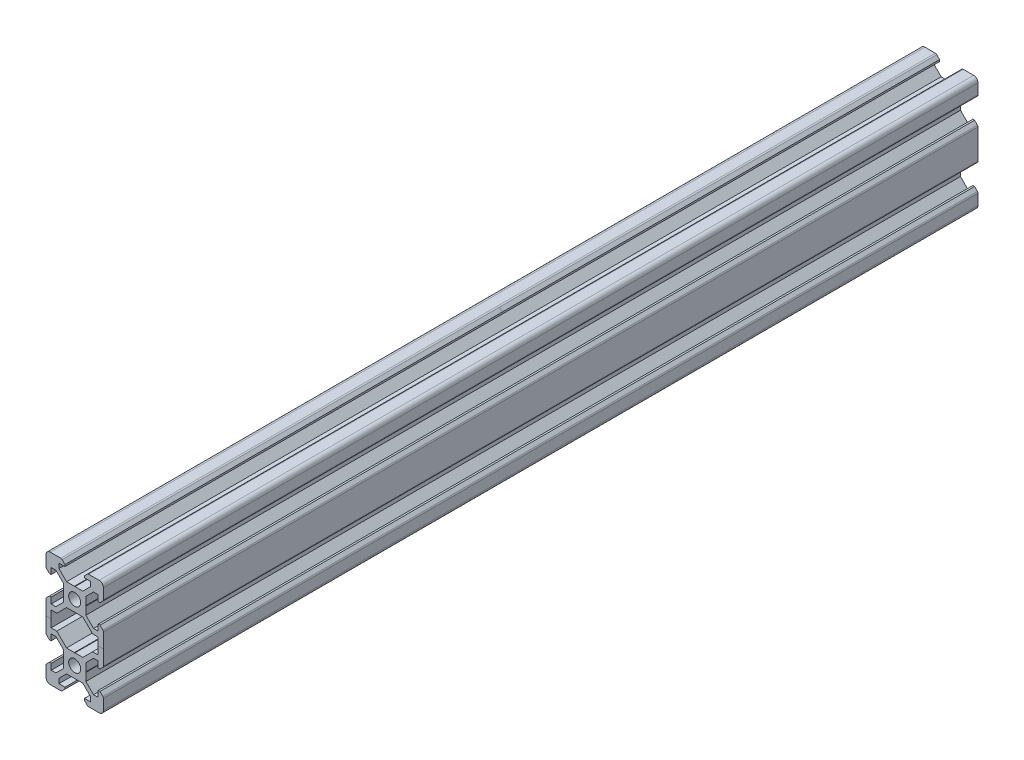
from build123d import *

# Parameters (mm, degrees)
SKETCH1_R           = 2.1
BOSS_EXTRUDE2_DEPTH = 304.8


with BuildPart() as part:
    # Sketch1 → Boss-Extrude2 (new body)
    with BuildSketch(Plane.XY):
        with BuildLine():
            Line((-8.5, 10), (-4.862792737, 10))
            ThreePointArc((-4.862792737, 10), (-4.598292737, 9.947387679), (-4.374060464, 9.797560464))
            Line((-4.374060464, 9.797560464), (-3.3865, 8.81))
            Line((-3.3865, 8.81), (-3.3865, 8.2))
            Line((-3.3865, 8.2), (-5.5, 8.2))
            Line((-5.5, 8.2), (-5.5, 6.561))
            Line((-5.5, 6.561), (-2.8395, 3.9005))
            Line((-2.8395, 3.9005), (-0.1, 3.9005))
            Line((-0.1, 3.9005), (0, 3.8005))
            Line((0, 3.8005), (0.1, 3.9005))
            Line((0.1, 3.9005), (2.8395, 3.9005))
            Line((2.8395, 3.9005), (5.5, 6.561))
            Line((5.5, 6.561), (5.5, 8.2))
            Line((5.5, 8.2), (3.3865, 8.2))
            Line((3.3865, 8.2), (3.3865, 8.81))
            Line((3.3865, 8.81), (4.374060464, 9.797560464))
            ThreePointArc((4.374060464, 9.797560464), (4.598292737, 9.947387679), (4.862792737, 10))
            Line((4.862792737, 10), (8.5, 10))
            ThreePointArc((8.5, 10), (9.560660172, 9.560660172), (10, 8.5))
            Line((10, 8.5), (10, 4.862792737))
            ThreePointArc((10, 4.862792737), (9.947387679, 4.598292737), (9.797560464, 4.374060464))
            Line((9.797560464, 4.374060464), (8.81, 3.3865))
            Line((8.81, 3.3865), (8.2, 3.3865))
            Line((8.2, 3.3865), (8.2, 5.5))
            Line((8.2, 5.5), (6.561, 5.5))
            Line((6.561, 5.5), (3.9005, 2.8395))
            Line((3.9005, 2.8395), (3.9005, 0.1))
            Line((3.9005, 0.1), (3.8005, 0))
            Line((3.8005, 0), (3.9005, -0.1))
            Line((3.9005, -0.1), (3.9005, -2.8395))
            Line((3.9005, -2.8395), (6.561, -5.5))
            Line((6.561, -5.5), (8.2, -5.5))
            Line((8.2, -5.5), (8.2, -3.3865))
            Line((8.2, -3.3865), (8.81, -3.3865))
            Line((8.81, -3.3865), (9.797560464, -4.374060464))
            ThreePointArc((9.797560464, -4.374060464), (9.947387679, -4.598292737), (10, -4.862792737))
            Line((10, -4.862792737), (10, -15.137207263))
            ThreePointArc((10, -15.137207263), (9.947387679, -15.401707263), (9.797560464, -15.625939536))
            Line((9.797560464, -15.625939536), (8.81, -16.6135))
            Line((8.81, -16.6135), (8.2, -16.6135))
            Line((8.2, -16.6135), (8.2, -14.5))
            Line((8.2, -14.5), (6.561, -14.5))
            Line((6.561, -14.5), (3.9005, -17.1605))
            Line((3.9005, -17.1605), (3.9005, -19.9))
            Line((3.9005, -19.9), (3.8005, -20))
            Line((3.8005, -20), (3.9005, -20.1))
            Line((3.9005, -20.1), (3.9005, -22.8395))
            Line((3.9005, -22.8395), (6.561, -25.5))
            Line((6.561, -25.5), (8.2, -25.5))
            Line((8.2, -25.5), (8.2, -23.3865))
            Line((8.2, -23.3865), (8.81, -23.3865))
            Line((8.81, -23.3865), (9.797560464, -24.374060464))
            ThreePointArc((9.797560464, -24.374060464), (9.947387679, -24.598292737), (10, -24.862792737))
            Line((10, -24.862792737), (10, -28.5))
            ThreePointArc((10, -28.5), (9.560660172, -29.560660172), (8.5, -30))
            Line((8.5, -30), (4.862792737, -30))
            ThreePointArc((4.862792737, -30), (4.598292737, -29.947387679), (4.374060464, -29.797560464))
            Line((4.374060464, -29.797560464), (3.3865, -28.81))
            Line((3.3865, -28.81), (3.3865, -28.2))
            Line((3.3865, -28.2), (5.5, -28.2))
            Line((5.5, -28.2), (5.5, -26.561))
            Line((5.5, -26.561), (2.8395, -23.9005))
            Line((2.8395, -23.9005), (0.1, -23.9005))
            Line((0.1, -23.9005), (0, -23.8005))
            Line((0, -23.8005), (-0.1, -23.9005))
            Line((-0.1, -23.9005), (-2.8395, -23.9005))
            Line((-2.8395, -23.9005), (-5.5, -26.561))
            Line((-5.5, -26.561), (-5.5, -28.2))
            Line((-5.5, -28.2), (-3.3865, -28.2))
            Line((-3.3865, -28.2), (-3.3865, -28.81))
            Line((-3.3865, -28.81), (-4.374060464, -29.797560464))
            ThreePointArc((-4.374060464, -29.797560464), (-4.598292737, -29.947387679), (-4.862792737, -30))
            Line((-4.862792737, -30), (-8.5, -30))
            ThreePointArc((-8.5, -30), (-9.560660172, -29.560660172), (-10, -28.5))
            Line((-10, -28.5), (-10, -24.862792737))
            ThreePointArc((-10, -24.862792737), (-9.947387679, -24.598292737), (-9.797560464, -24.374060464))
            Line((-9.797560464, -24.374060464), (-8.81, -23.3865))
            Line((-8.81, -23.3865), (-8.2, -23.3865))
            Line((-8.2, -23.3865), (-8.2, -25.5))
            Line((-8.2, -25.5), (-6.561, -25.5))
            Line((-6.561, -25.5), (-3.9005, -22.8395))
            Line((-3.9005, -22.8395), (-3.9005, -20.1))
            Line((-3.9005, -20.1), (-3.8005, -20))
            Line((-3.8005, -20), (-3.9005, -19.9))
            Line((-3.9005, -19.9), (-3.9005, -17.1605))
            Line((-3.9005, -17.1605), (-6.561, -14.5))
            Line((-6.561, -14.5), (-8.2, -14.5))
            Line((-8.2, -14.5), (-8.2, -16.6135))
            Line((-8.2, -16.6135), (-8.81, -16.6135))
            Line((-8.81, -16.6135), (-9.797560464, -15.625939536))
            ThreePointArc((-9.797560464, -15.625939536), (-9.947387679, -15.401707263), (-10, -15.137207263))
            Line((-10, -15.137207263), (-10, -4.862792737))
            ThreePointArc((-10, -4.862792737), (-9.947387679, -4.598292737), (-9.797560464, -4.374060464))
            Line((-9.797560464, -4.374060464), (-8.81, -3.3865))
            Line((-8.81, -3.3865), (-8.2, -3.3865))
            Line((-8.2, -3.3865), (-8.2, -5.5))
            Line((-8.2, -5.5), (-6.561, -5.5))
            Line((-6.561, -5.5), (-3.9005, -2.8395))
            Line((-3.9005, -2.8395), (-3.9005, -0.1))
            Line((-3.9005, -0.1), (-3.8005, 0))
            Line((-3.8005, 0), (-3.9005, 0.1))
            Line((-3.9005, 0.1), (-3.9005, 2.8395))
            Line((-3.9005, 2.8395), (-6.561, 5.5))
            Line((-6.561, 5.5), (-8.2, 5.5))
            Line((-8.2, 5.5), (-8.2, 3.3865))
            Line((-8.2, 3.3865), (-8.81, 3.3865))
            Line((-8.81, 3.3865), (-9.797560464, 4.374060464))
            ThreePointArc((-9.797560464, 4.374060464), (-9.947387679, 4.598292737), (-10, 4.862792737))
            Line((-10, 4.862792737), (-10, 8.5))
            ThreePointArc((-10, 8.5), (-9.560660172, 9.560660172), (-8.5, 10))
        make_face()
        with Locations(Location((0, 0, 0), (0, 0, 180))):
            Circle(SKETCH1_R, mode=Mode.SUBTRACT)
        with Locations(Location((0, -20, 0), (0, 0, 180))):
            Circle(SKETCH1_R, mode=Mode.SUBTRACT)
        Polygon((-8.2, -12.7), (-8.2, -7.3), (-6.239, -7.3), (-5.5, -6.561), (-2.8395, -3.9005), (-0.1, -3.9005), (0, -3.8005), (0.1, -3.9005), (2.8395, -3.9005), (5.5, -6.561), (6.239, -7.3), (8.2, -7.3), (8.2, -12.7), (6.239, -12.7), (5.5, -13.439), (2.8395, -16.0995), (0.1, -16.0995), (0, -16.1995), (-0.1, -16.0995), (-2.8395, -16.0995), (-5.5, -13.439), (-6.239, -12.7), align=None, mode=Mode.SUBTRACT)
    extrude(amount=BOSS_EXTRUDE2_DEPTH)


solid = part.part
